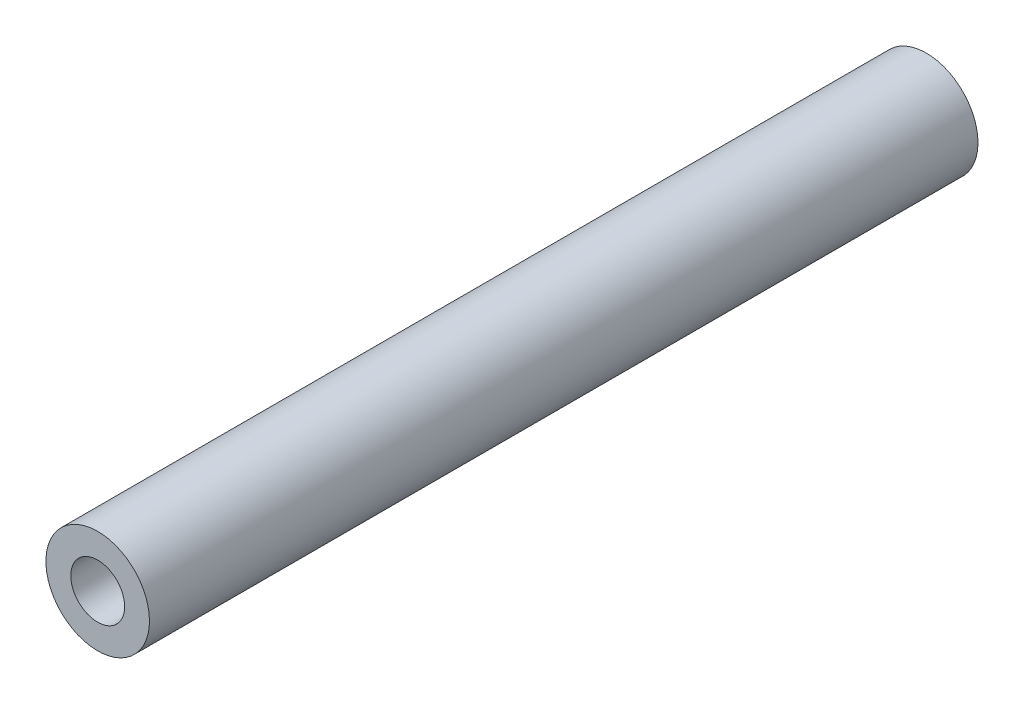
from build123d import *

# Parameters (mm, degrees)
EXTRUDE1_DEPTH      = 50.8
EXTRUDE1_DEPTH_BACK = 50.8
SKETCH1_R           = 6.35
SKETCH1_R_2         = 3.302


with BuildPart() as part:
    # Sketch1 → Extrude1 (new, two sides: drawn at the far end of the back side and taken through both)
    with BuildSketch(Plane.XY.offset(-EXTRUDE1_DEPTH_BACK)):
        Circle(SKETCH1_R)
        Circle(SKETCH1_R_2, mode=Mode.SUBTRACT)
    extrude(amount=EXTRUDE1_DEPTH + EXTRUDE1_DEPTH_BACK)


solid = part.part
